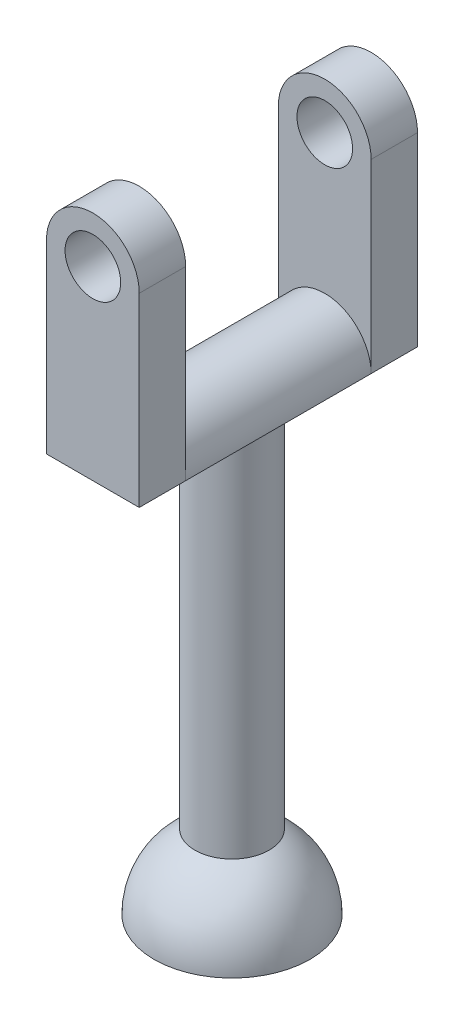
from build123d import *

# Parameters (mm, degrees)
SKETCH1_W           = 12.7
SKETCH1_H           = 101.6
BOSS_EXTRUDE1_DEPTH = 19.05
FILLET2_RADIUS      = 6.35
FILLET2_LENGTH      = 38.1
SKETCH2_R           = 3.81
CUT_EXTRUDE1_DEPTH  = 38.1
FILLET3_RADIUS      = 6.35
FILLET3_LENGTH      = 38.1
SKETCH3_W           = 25.4
SKETCH3_H           = 25.4
CUT_EXTRUDE2_DEPTH  = 56.72102386
FILLET4_RADIUS      = 6.35
FILLET4_LENGTH      = 25.4
SKETCH4_W           = 45.439126892
SKETCH4_H           = 74.581358872
CUT_EXTRUDE3_DEPTH  = 56.72102386
SKETCH5_R           = 5.08
BOSS_EXTRUDE2_DEPTH = 50.8


with BuildPart() as part:
    # Sketch1 → Boss-Extrude1 (new, symmetric)
    with BuildSketch(Plane.XY):
        Rectangle(SKETCH1_W, SKETCH1_H)
    extrude(amount=BOSS_EXTRUDE1_DEPTH, both=True)

    # Fillet2: full round fillet: the end face becomes a half cylinder, R = half its width
    fillet2_face = Plane((0, -50.8, 0), x_dir=(0, 0, 1), z_dir=(0, -1, 0))  # on the end face: x along it, z out of the body
    fillet2_slab = fillet2_face.offset(-FILLET2_RADIUS / 2) * Box(FILLET2_LENGTH, 2 * FILLET2_RADIUS, FILLET2_RADIUS, mode=Mode.PRIVATE)  # the body's end, R deep
    fillet2_round = Plane((0, -44.45, 0), x_dir=(0, -1, 0), z_dir=(0, 0, 1)) * Cylinder(FILLET2_RADIUS, FILLET2_LENGTH, mode=Mode.PRIVATE)  # its axis R under the face
    add(fillet2_slab - fillet2_round, mode=Mode.SUBTRACT)

    # Sketch2 → Cut-Extrude1 (cut)
    with BuildSketch(Plane.XY.offset(19.05)):
        with Locations((0, -44.45)):
            Circle(SKETCH2_R)
    cut_extrude1 = extrude(amount=-CUT_EXTRUDE1_DEPTH, mode=Mode.SUBTRACT)

    # Mirror3: Cut-Extrude1 across plane
    add(cut_extrude1.mirror(Plane.ZX), mode=Mode.SUBTRACT)

    # Fillet3: full round fillet: the end face becomes a half cylinder, R = half its width
    fillet3_face = Plane((0, 50.8, 0), x_dir=(0, 0, 1), z_dir=(0, 1, 0))  # on the end face: x along it, z out of the body
    fillet3_slab = fillet3_face.offset(-FILLET3_RADIUS / 2) * Box(FILLET3_LENGTH, 2 * FILLET3_RADIUS, FILLET3_RADIUS, mode=Mode.PRIVATE)  # the body's end, R deep
    fillet3_round = Plane((0, 44.45, 0), x_dir=(0, 1, 0), z_dir=(0, 0, 1)) * Cylinder(FILLET3_RADIUS, FILLET3_LENGTH, mode=Mode.PRIVATE)  # its axis R under the face
    add(fillet3_slab - fillet3_round, mode=Mode.SUBTRACT)

    # Sketch3 → Cut-Extrude2 (cut, through all)
    with BuildSketch(Plane.ZY.offset(6.35)):
        with Locations((0, 38.1)):
            Rectangle(SKETCH3_W, SKETCH3_H)
    extrude(amount=-CUT_EXTRUDE2_DEPTH, mode=Mode.SUBTRACT)

    # Fillet4: full round fillet: the end face becomes a half cylinder, R = half its width
    fillet4_face = Plane((0, 25.4, 0), x_dir=(0, 0, -1), z_dir=(0, 1, 0))  # on the end face: x along it, z out of the body
    fillet4_slab = fillet4_face.offset(-FILLET4_RADIUS / 2) * Box(FILLET4_LENGTH, 2 * FILLET4_RADIUS, FILLET4_RADIUS, mode=Mode.PRIVATE)  # the body's end, R deep
    fillet4_round = Plane((0, 19.05, 0), x_dir=(0, 1, 0), z_dir=(0, 0, -1)) * Cylinder(FILLET4_RADIUS, FILLET4_LENGTH, mode=Mode.PRIVATE)  # its axis R under the face
    add(fillet4_slab - fillet4_round, mode=Mode.SUBTRACT)

    # Sketch4 → Cut-Extrude3 (cut, through all)
    with BuildSketch(Plane(origin=(6.35, 0, 0), x_dir=(0, 0, -1), z_dir=(1, 0, 0))):
        with Locations((3.669563446, -18.240679436)):
            Rectangle(SKETCH4_W, SKETCH4_H)
    extrude(amount=-CUT_EXTRUDE3_DEPTH, mode=Mode.SUBTRACT)

    # Sketch5 → Boss-Extrude2 (add)
    with BuildSketch(Plane.XZ.offset(-19.05)):
        with Locations(Location((0, 0, 0), (0, 0, 180))):
            Circle(SKETCH5_R)
    extrude(amount=BOSS_EXTRUDE2_DEPTH)

    # Sketch8 → Revolve-Thin1 (revolve)
    with BuildSketch(Plane.XY):
        with BuildLine():
            ThreePointArc((10.16, -41.91), (7.184204897, -34.725795103), (0, -31.75))
            Line((0, -31.75), (0, -31.242))
            ThreePointArc((0, -31.242), (7.543415142, -34.366584858), (10.668, -41.91))
            Line((10.668, -41.91), (10.16, -41.91))
        make_face()
    revolve(axis=Axis((0, -58.668197781, 0), (0, 1, 0)))


solid = part.part
